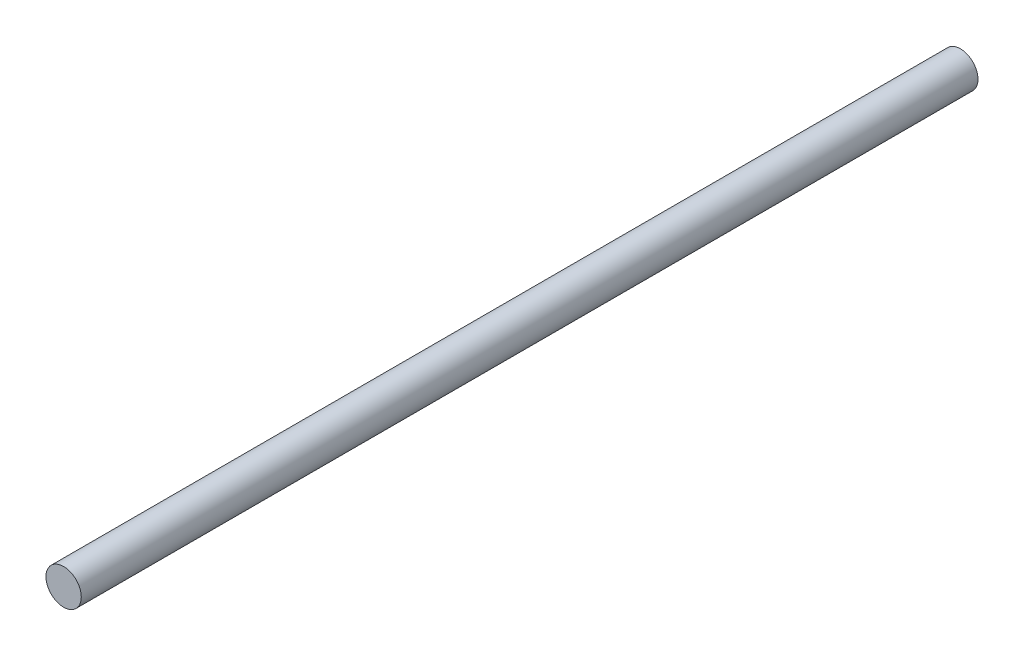
from build123d import *

# Parameters (mm, degrees)
ESQUISSE1_R        = 2.5
BOSS_EXTRU_1_DEPTH = 127


with BuildPart() as part:
    # Esquisse1 → Boss.-Extru.1 (new body)
    with BuildSketch(Plane.XY):
        Circle(ESQUISSE1_R)
    extrude(amount=BOSS_EXTRU_1_DEPTH)


solid = part.part
